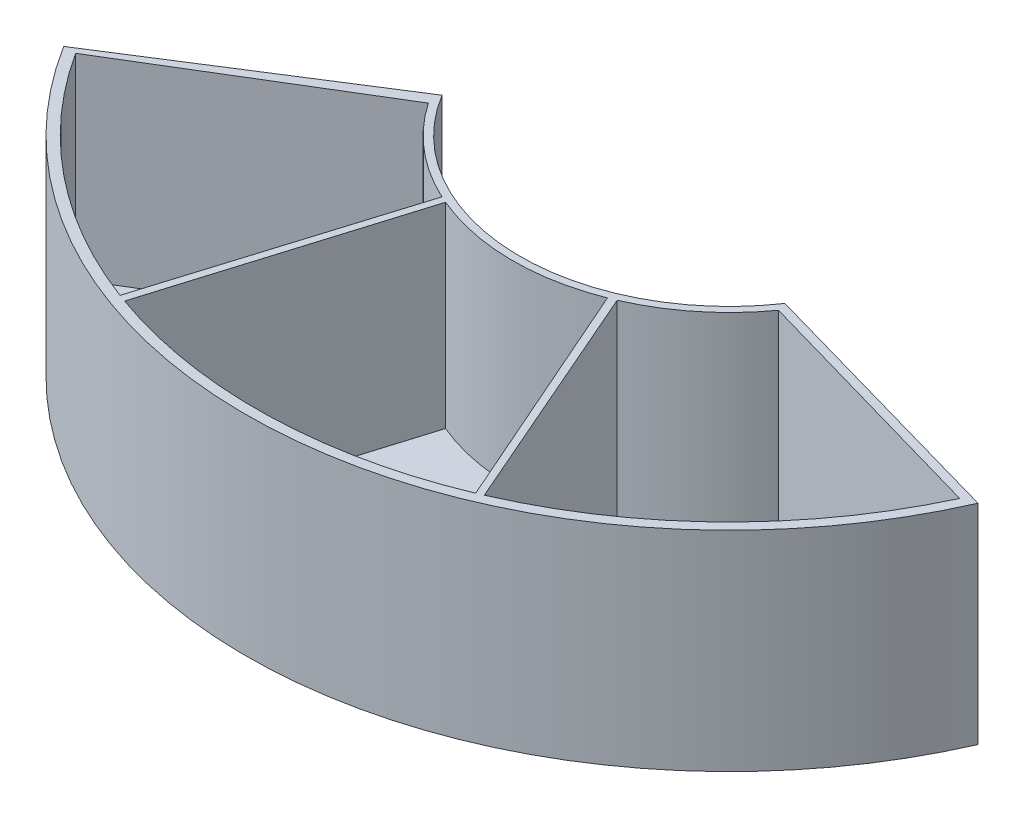
from build123d import *

# Parameters (mm, degrees)
BOSS_EXTRUDE1_DEPTH = 80
BOSS_EXTRUDE2_DEPTH = 5


with BuildPart() as part:
    # Sketch1 → Boss-Extrude1 (new body)
    with BuildSketch(Plane(origin=(0, 0, 0), x_dir=(1, 0, 0), z_dir=(0, 1, 0))):
        with BuildLine():
            Line((-68.405029852, -41.523820038), (-156.962867052, -97.747709945))
            ThreePointArc((-156.962867052, -97.747709945), (13.312357604, -184.430847657), (169.373640638, -74.192494834))
            Line((169.373640638, -74.192494834), (66.212991348, -44.936794682))
            ThreePointArc((66.212991348, -44.936794682), (-2.028141312, -79.996014791), (-68.405029852, -41.523820038))
        make_face()
        with BuildLine():
            Line((-34.725471354, -75.235438156), (-63.687790654, -169.483352526))
            ThreePointArc((-63.687790654, -169.483352526), (-113.842495993, -140.785750585), (-152.401202956, -97.747709945))
            Line((-152.401202956, -97.747709945), (-68.405029852, -46.765173005))
            ThreePointArc((-68.405029852, -46.765173005), (-53.494056391, -63.282030989), (-34.725471354, -75.235438156))
        make_face(mode=Mode.SUBTRACT)
        with BuildLine():
            Line((30.443645827, -77.067593345), (69.946567205, -166.997662253))
            ThreePointArc((69.946567205, -166.997662253), (4.833688489, -180.989991208), (-60.933223363, -170.493060716))
            Line((-60.933223363, -170.493060716), (-32.261228696, -76.324587377))
            ThreePointArc((-32.261228696, -76.324587377), (-0.981792411, -82.856898318), (30.443645827, -77.067593345))
        make_face(mode=Mode.SUBTRACT)
        with BuildLine():
            Line((67.248014437, -48.414192851), (164.278182262, -76.114520917))
            ThreePointArc((164.278182262, -76.114520917), (126.518982101, -129.513275883), (72.251766234, -166.013323977))
            Line((72.251766234, -166.013323977), (33.067262274, -75.978850221))
            ThreePointArc((33.067262274, -75.978850221), (52.01674028, -64.50184684), (67.248014437, -48.414192851))
        make_face(mode=Mode.SUBTRACT)
    extrude(amount=BOSS_EXTRUDE1_DEPTH)

    # Sketch4 → Boss-Extrude2 (add)
    with BuildSketch(Plane.XZ):
        with BuildLine():
            Line((-156.962867052, 97.747709945), (-68.405029852, 41.523820038))
            ThreePointArc((-68.405029852, 41.523820038), (-2.028141312, 79.996014791), (66.212991348, 44.936794682))
            Line((66.212991348, 44.936794682), (169.373640638, 74.192494834))
            ThreePointArc((169.373640638, 74.192494834), (13.312357604, 184.430847657), (-156.962867052, 97.747709945))
        make_face()
    extrude(amount=-BOSS_EXTRUDE2_DEPTH)


solid = part.part
